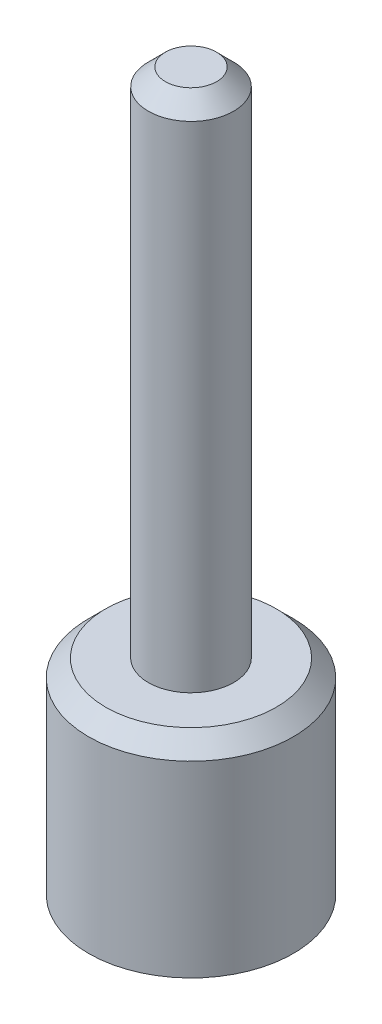
from build123d import *

# Parameters (mm, degrees)
SKETCH_1_R      = 6
EXTRUDE_1_DEPTH = 12
SKETCH_2_R      = 2.5
EXTRUDE_2_DEPTH = 30
CHAMFER_1_SIZE  = 1


with BuildPart() as part:
    # Эскиз1 → Вытянуть1 (new body)
    with BuildSketch(Plane(origin=(0, 0, 0), x_dir=(1, 0, 0), z_dir=(0, 1, 0))):
        with Locations(Location((0, 0, 0), (0, 0, 270))):
            Circle(SKETCH_1_R)
    extrude(amount=EXTRUDE_1_DEPTH)

    # Эскиз2 → Вытянуть2 (add)
    with BuildSketch(Plane(origin=(0, 12, 0), x_dir=(1, 0, 0), z_dir=(0, 1, 0))):
        with Locations(Location((0, 0, 0), (0, 0, 270))):
            Circle(SKETCH_2_R)
    extrude(amount=EXTRUDE_2_DEPTH)

    # Фаска1
    chamfer_1_edges = [part.edges().sort_by_distance(p)[0] for p in [
        (0, 12, -6),
        (0, 42, -2.5),
    ]]
    chamfer(chamfer_1_edges, length=CHAMFER_1_SIZE)


solid = part.part
